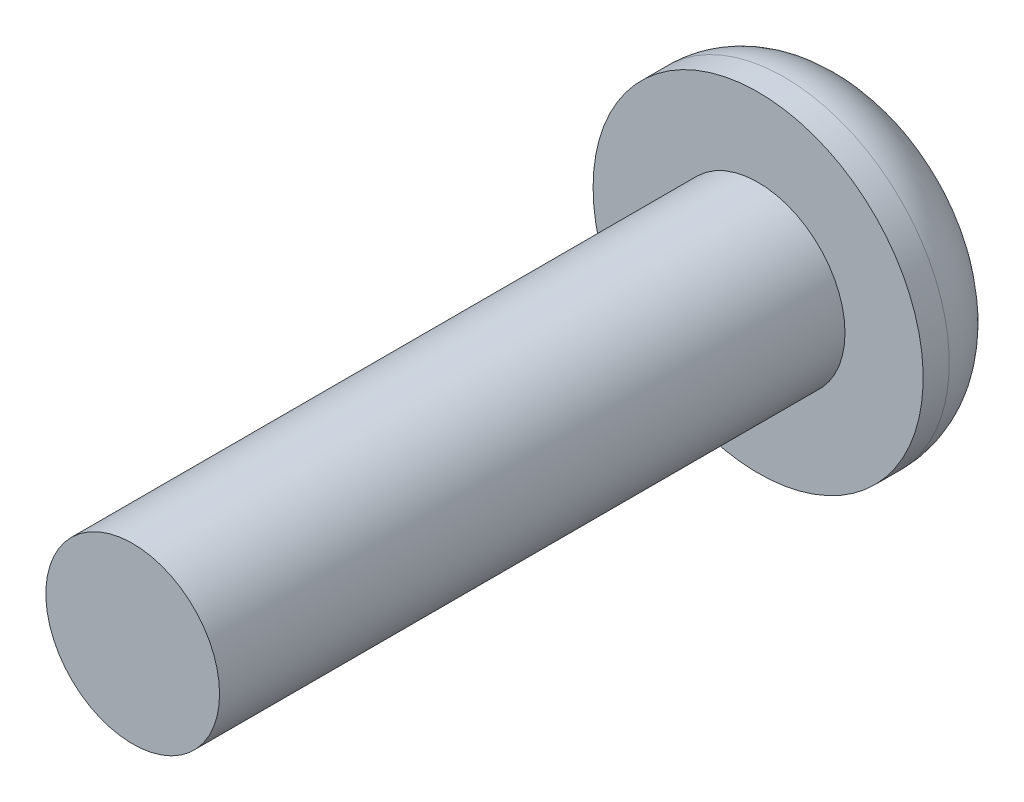
from build123d import *

# Parameters (mm, degrees)
SKETCH_1_R      = 2.5
EXTRUDE_1_DEPTH = 18
SKETCH_2_R      = 4.75
EXTRUDE_2_DEPTH = 2.75
FILLET_1_R      = 2


with BuildPart() as part:
    # 草图1 → 凸台-拉伸1 (new body)
    with BuildSketch(Plane.XY):
        Circle(SKETCH_1_R)
    extrude(amount=EXTRUDE_1_DEPTH)

    # 草图2 → 凸台-拉伸2 (add)
    with BuildSketch(Plane(origin=(0, 0, 0), x_dir=(-1, 0, 0), z_dir=(0, 0, -1))):
        Circle(SKETCH_2_R)
    extrude(amount=EXTRUDE_2_DEPTH)

    # 圆角1
    fillet_1_edges = [part.edges().sort_by_distance(p)[0] for p in [
        (4.75, 0, -2.75),
    ]]
    fillet(fillet_1_edges, radius=FILLET_1_R)


solid = part.part
